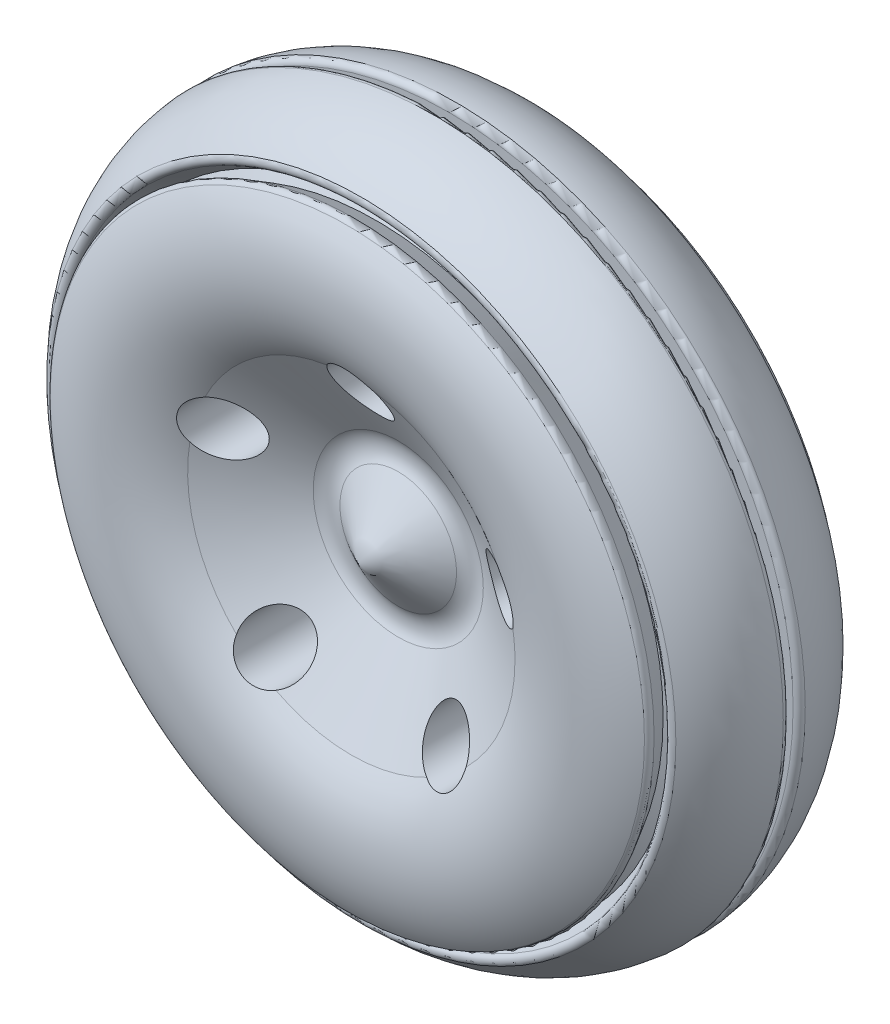
from build123d import *

# Parameters (mm, degrees)
CUT_EXTRUDE1_DEPTH      = 218.653665465
CUT_EXTRUDE1_DEPTH_BACK = 218.653665465
SKETCH3_R               = 12.5


with BuildPart() as part:
    # Sketch1 → Revolve1 (revolve)
    with BuildSketch(Plane(origin=(0, 0, 0), x_dir=(0, 0, -1), z_dir=(1, 0, 0)), mode=Mode.PRIVATE) as revolve1_sk:
        with BuildLine():
            Line((-20, 24.992590118), (-37.5, 0))
            Line((-37.5, 0), (37.5, 0))
            Line((37.5, 0), (20, 24.992590118))
            ThreePointArc((20, 24.992590118), (18.191520443, 30.728354481), (20, 36.464118845))
            Line((20, 36.464118845), (40.121786179, 70.163071978))
            ThreePointArc((40.121786179, 70.163071978), (49.977650768, 98.505201128), (41.833277754, 127.385705621))
            ThreePointArc((41.833277754, 127.385705621), (40.320764341, 128.448412266), (38.491613866, 128.181483849))
            Line((38.491613866, 128.181483849), (29.344923765, 122.900639857))
            Line((29.344923765, 122.900639857), (27.344923765, 126.364741472))
            Line((27.344923765, 126.364741472), (35.297519419, 130.956174714))
            ThreePointArc((35.297519419, 130.956174714), (36.523822816, 132.777841243), (35.839494125, 134.864461287))
            ThreePointArc((35.839494125, 134.864461287), (21.604477954, 145.091535041), (4.714455315, 149.777242904))
            ThreePointArc((4.714455315, 149.777242904), (2.796369169, 149.137611262), (1.978732549, 147.288380758))
            Line((1.978732549, 147.288380758), (1.978732549, 135))
            Line((1.978732549, 135), (0.021267451, 135))
            Line((0.021267451, 135), (-0.021267451, 135))
            Line((-0.021267451, 135), (-1.978732549, 135))
            Line((-1.978732549, 135), (-1.978732549, 147.288380758))
            ThreePointArc((-1.978732549, 147.288380758), (-2.796369169, 149.137611262), (-4.714455315, 149.777242904))
            ThreePointArc((-4.714455315, 149.777242904), (-21.604477954, 145.091535041), (-35.839494125, 134.864461287))
            ThreePointArc((-35.839494125, 134.864461287), (-36.523822816, 132.777841243), (-35.297519419, 130.956174714))
            Line((-35.297519419, 130.956174714), (-27.344923765, 126.364741472))
            Line((-27.344923765, 126.364741472), (-29.344923765, 122.900639857))
            Line((-29.344923765, 122.900639857), (-38.491613866, 128.181483849))
            ThreePointArc((-38.491613866, 128.181483849), (-40.320764341, 128.448412266), (-41.833277754, 127.385705621))
            ThreePointArc((-41.833277754, 127.385705621), (-49.977650768, 98.505201128), (-40.121786179, 70.163071978))
            Line((-40.121786179, 70.163071978), (-20, 36.464118845))
            ThreePointArc((-20, 36.464118845), (-18.191520443, 30.728354481), (-20, 24.992590118))
        make_face()
    revolve(revolve1_sk.sketch.rotate(Axis((0, 0, 37.5), (0, 0, -1)), 90), axis=Axis((0, 0, 37.5), (0, 0, -1)))

    # Sketch3 → Cut-Extrude1 (cut, two sides: drawn at the far end of the back side and taken through both)
    with BuildSketch(Plane.XY.offset(-CUT_EXTRUDE1_DEPTH_BACK)):
        with Locations(Location((0, 62.5, 0), (0, 0, 33.410125484))):
            Circle(SKETCH3_R)
        with Locations(Location((59.441032268, 19.313562148, 0), (0, 0, 321.410125392))):
            Circle(SKETCH3_R)
        with Locations(Location((36.736578268, -50.563562148, 0), (0, 0, 2.589874543))):
            Circle(SKETCH3_R)
        with Locations(Location((-36.736578268, -50.563562148, 0), (0, 0, 290.589874516))):
            Circle(SKETCH3_R)
        with Locations(Location((-59.441032268, 19.313562148, 0), (0, 0, 105.410125392))):
            Circle(SKETCH3_R)
    extrude(amount=CUT_EXTRUDE1_DEPTH + CUT_EXTRUDE1_DEPTH_BACK, mode=Mode.SUBTRACT)


solid = part.part
